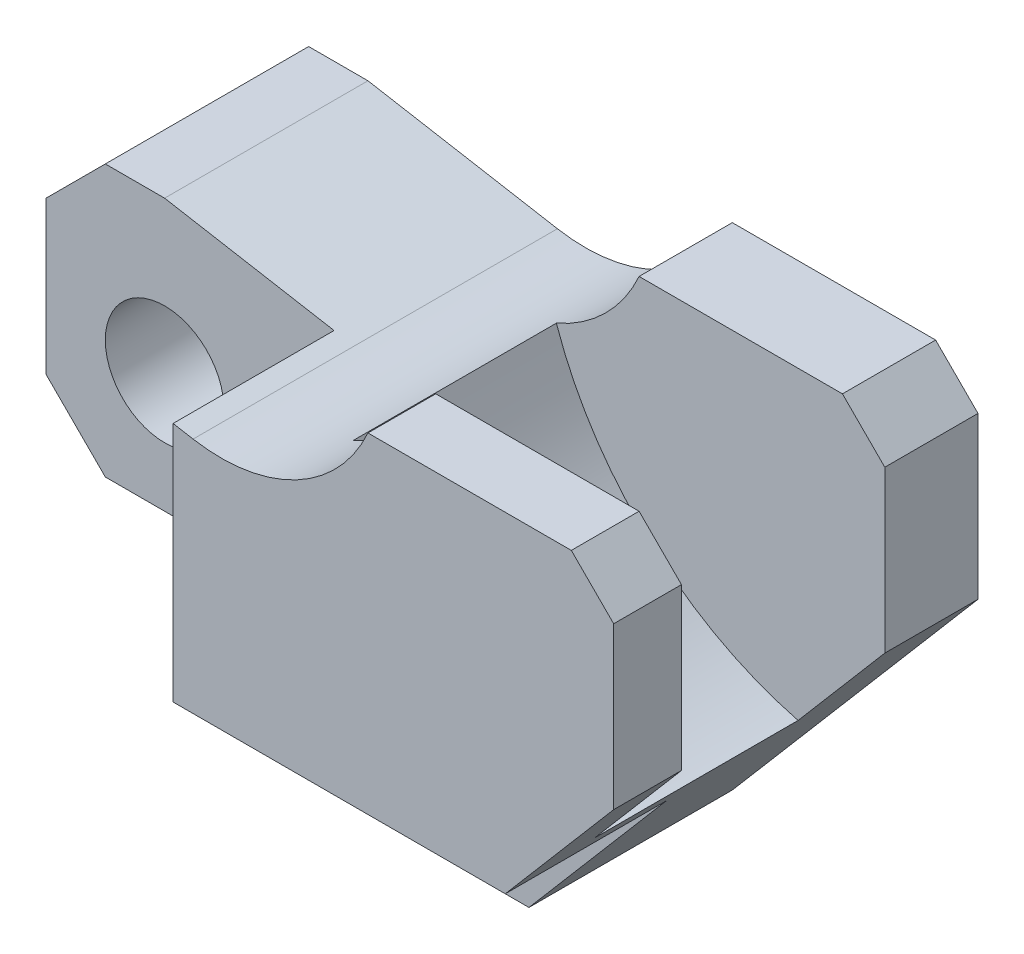
from build123d import *

# Parameters (mm, degrees)
SKETCH_2_R          = 7
EXTRUDE_1_DEPTH     = 43
SKETCH_5_W          = 34
SKETCH_5_H          = 19
CUT_EXTRUDE_2_DEPTH = 35
SKETCH_6_W          = 62.498626105
SKETCH_6_H          = 38.983271372
CUT_EXTRUDE_3_DEPTH = 19
CUT_EXTRUDE_START   = -32
CUT_EXTRUDE_5_DEPTH = 24


with BuildPart() as part:
    # 草圖2 → 填料-伸長1 (new body)
    with BuildSketch(Plane.XY):
        with BuildLine():
            Line((-14, 11), (-14, -7))
            Line((-14, -7), (-7, -14))
            Line((-7, -14), (25.575538911, -14))
            ThreePointArc((25.575538911, -14), (28.840774692, -15.213413768), (30.521177653, -18.264705882))
            ThreePointArc((30.521177653, -18.264705882), (32.858007856, -26.115672061), (37.296980053, -33))
            Line((37.296980053, -33), (43, -33))
            Line((43, -33), (72, 1))
            Line((72, 1), (72, 20))
            Line((72, 20), (67, 25))
            Line((67, 25), (43, 25))
            ThreePointArc((43, 25), (34.561098706, 15.982044142), (22.361380836, 14.057085233))
            Line((22.361380836, 14.057085233), (0, 18))
            Line((0, 18), (-7, 18))
            Line((-7, 18), (-14, 11))
        make_face()
        Circle(SKETCH_2_R, mode=Mode.SUBTRACT)
    extrude(amount=EXTRUDE_1_DEPTH)

    # 草圖5 → 除料-伸長2 (cut, symmetric)
    with BuildSketch(Plane(origin=(0, 0, 0), x_dir=(1, 0, 0), z_dir=(0, 1, 0))):
        with Locations((3, -33.5)):
            Rectangle(SKETCH_5_W, SKETCH_5_H)
    extrude(amount=CUT_EXTRUDE_2_DEPTH, both=True, mode=Mode.SUBTRACT)

    # 草圖6 → 除料-伸長3 (cut)
    with BuildSketch(Plane.XY.offset(43)):
        with Locations((47.348473669, -33.491635686)):
            Rectangle(SKETCH_6_W, SKETCH_6_H)
    extrude(amount=-CUT_EXTRUDE_3_DEPTH, mode=Mode.SUBTRACT)

    # 草圖9 → 除料-伸長5 (cut)
    with BuildSketch(Plane.XY.offset(43).offset(CUT_EXTRUDE_START)):
        with BuildLine():
            ThreePointArc((33.236936549, 15.344294617), (44.184262982, -1.419294771), (61.764705882, -11))
            Line((61.764705882, -11), (72, 1))
            Line((72, 1), (72, 20))
            Line((72, 20), (67, 25))
            Line((67, 25), (43, 25))
            ThreePointArc((43, 25), (39.021244343, 19.259333621), (33.236936549, 15.344294617))
        make_face()
        with BuildLine():
            Line((72, 1), (61.764705882, -11))
            ThreePointArc((61.764705882, -11), (97.113272797, -3.706821839), (113, 28.701873436))
            ThreePointArc((113, 28.701873436), (65.22820561, 69.138772436), (33.236936549, 15.344294617))
            ThreePointArc((33.236936549, 15.344294617), (39.021244343, 19.259333621), (43, 25))
            Line((43, 25), (67, 25))
            Line((67, 25), (72, 20))
            Line((72, 20), (72, 1))
        make_face()
    extrude(amount=CUT_EXTRUDE_5_DEPTH, mode=Mode.SUBTRACT)


solid = part.part
